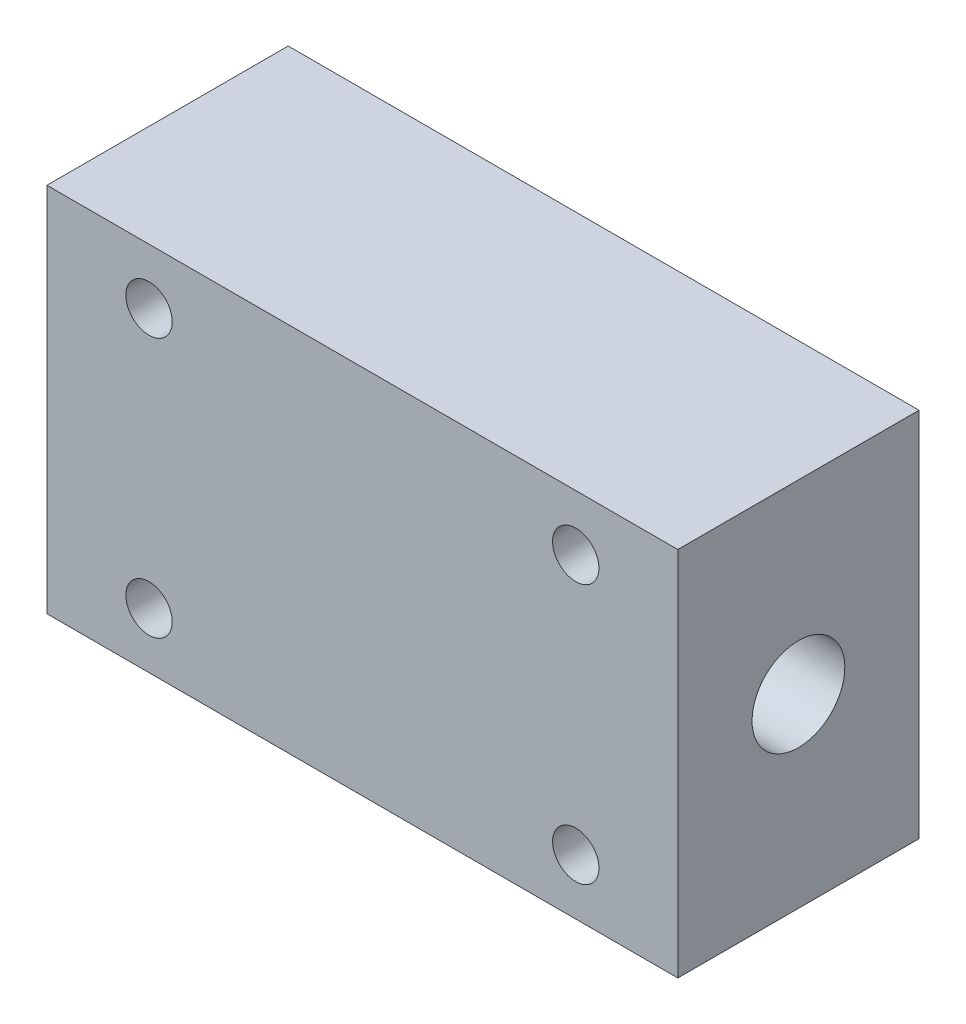
from build123d import *

# Parameters (mm, degrees)
SCHIZZO1_W                   = 68
SCHIZZO1_H                   = 40
ESTRUSIONE_ESTRUSIONE1_DEPTH = 26
SCHIZZO2_R                   = 5
TAGLIO_ESTRUSIONE1_DEPTH     = 84.066238629
SCHIZZO3_R                   = 2.5
TAGLIO_ESTRUSIONE2_DEPTH     = 84.066238629


with BuildPart() as part:
    # Schizzo1 → Estrusione-Estrusione1 (new body)
    with BuildSketch(Plane.XY):
        with Locations((34, 20)):
            Rectangle(SCHIZZO1_W, SCHIZZO1_H)
    extrude(amount=-ESTRUSIONE_ESTRUSIONE1_DEPTH)

    # Schizzo2 → Taglio-Estrusione1 (cut, through all)
    with BuildSketch(Plane.ZY):
        with Locations(Location((-13, 20, 0), (0, 0, 270))):
            Circle(SCHIZZO2_R)
    extrude(amount=-TAGLIO_ESTRUSIONE1_DEPTH, mode=Mode.SUBTRACT)

    # Schizzo3 → Taglio-Estrusione2 (cut, through all)
    with BuildSketch(Plane(origin=(0, 0, -26), x_dir=(-1, 0, 0), z_dir=(0, 0, -1))):
        with Locations((-11, 34)):
            Circle(SCHIZZO3_R)
        with Locations((-57, 34)):
            Circle(SCHIZZO3_R)
        with Locations((-57, 6)):
            Circle(SCHIZZO3_R)
        with Locations((-11, 6)):
            Circle(SCHIZZO3_R)
    extrude(amount=-TAGLIO_ESTRUSIONE2_DEPTH, mode=Mode.SUBTRACT)


solid = part.part
